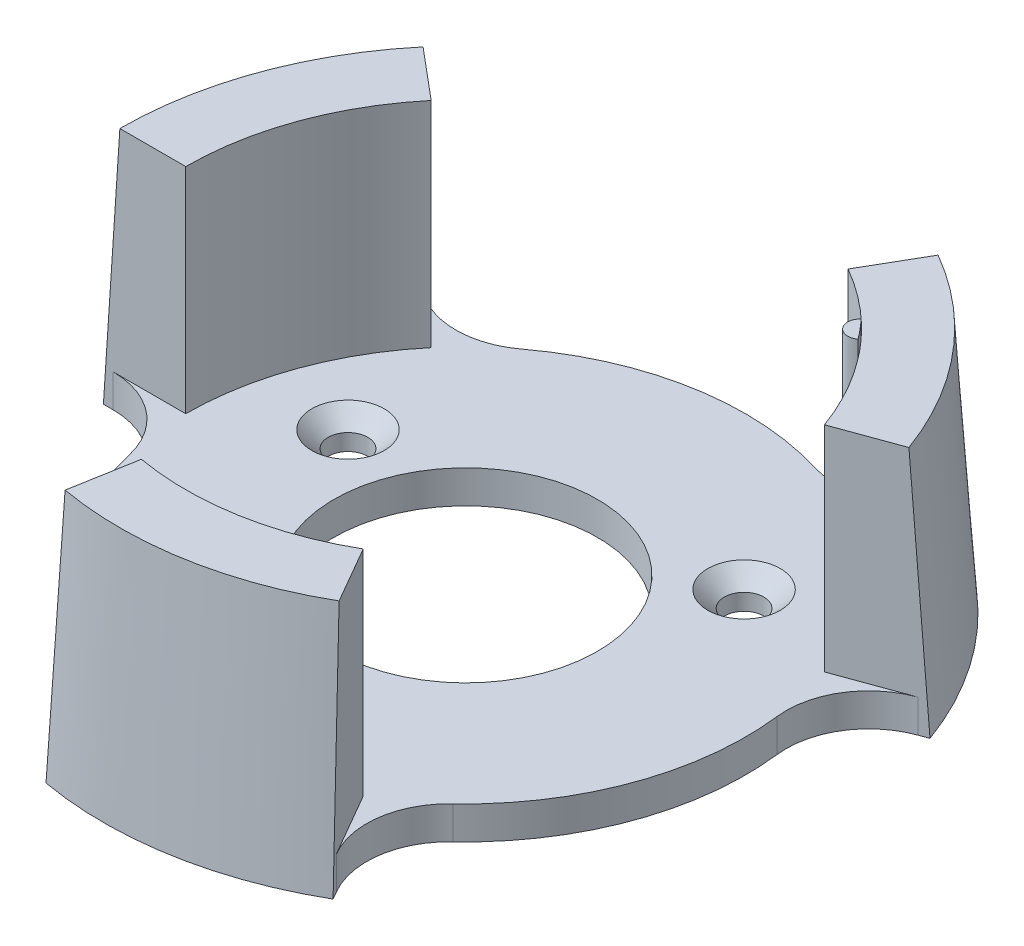
from build123d import *

# Parameters (mm, degrees)
SKETCH1_R                                    = 17
SKETCH1_R_2                                  = 8
BOSS_EXTRUDE4_DEPTH                          = 2
REVOLVE2_ANGLE                               = 40
CIRPATTERN1_COUNT                            = 3
FILLET1_R                                    = 5
CSK_FOR_M2_COUNTERSUNK_FLAT_HEAD_SCR_2_COUNT = 2
CSK_FOR_M2_COUNTERSUNK_FLAT_HEAD_SCR_2_PITCH = 20.784609691
CSK_FOR_M2_COUNTERSUNK_FLAT_HEAD_SCR_3_COUNT = 2
CSK_FOR_M2_COUNTERSUNK_FLAT_HEAD_SCR_3_PITCH = 20.747553677
BOSS_EXTRUDE6_DEPTH                          = 14


with BuildPart() as part:
    # Sketch1 → Boss-Extrude4 (new body)
    with BuildSketch(Plane(origin=(0, 0, 0), x_dir=(1, 0, 0), z_dir=(0, 1, 0))):
        with Locations(Location((0, 0, 0), (0, 0, 270))):
            Circle(SKETCH1_R)
        with Locations(Location((0, 0, 0), (0, 0, 270))):
            Circle(SKETCH1_R_2, mode=Mode.SUBTRACT)
    extrude(amount=BOSS_EXTRUDE4_DEPTH)

    # Sketch5 → Revolve2 (revolve)
    with BuildSketch(Plane.XY):
        Polygon((-17, 0), (-22, 0), (-21, 15), (-17, 15), align=None)
    revolve2 = revolve(axis=Axis((0, 9.813682869, 0), (0, -1, 0)), revolution_arc=REVOLVE2_ANGLE)

    # CirPattern1: Revolve2 ×3 about axis
    cirpattern1_axis = Axis((0, 0, 0), (0, 1, 0))
    for i in range(1, CIRPATTERN1_COUNT):
        add(revolve2.rotate(cirpattern1_axis, i * 360 / CIRPATTERN1_COUNT))

    # Fillet1
    fillet1_edges = [part.edges().sort_by_distance(p)[0] for p in [
        (-13.022755533, 1, -10.927389365),
        (-17, 1, 0),
        (-2.95201902, 1, 16.741731801),
        (8.5, 1, 14.722431864),
        (15.974774553, 1, -5.814342437),
        (8.5, 1, -14.722431864),
    ]]
    fillet(fillet1_edges, radius=FILLET1_R)

    # Sketch13 → CSK for M2 Countersunk Flat Head Screw1 (revolve, cut)
    with BuildSketch(Plane(origin=(2.083778132, 2, 11.817693036), x_dir=(0, 0, 1), z_dir=(1, 0, 0))):
        Polygon((0, 0), (0, 2), (1.2, 2), (1.2, 1), (2.2, 0), align=None)
    csk_for_m2_countersunk_flat_head_screw1 = revolve(axis=Axis((2.083778132, 8.35, 11.817693036), (0, -1, 0)), mode=Mode.SUBTRACT)

    # CSK for M2 Countersunk Flat Head Scr 2: CSK for M2 Countersunk Flat Head Screw1 ×2
    with Locations(*[Vector(0.3420201433256633, 0, -0.9396926207859104) * (i * CSK_FOR_M2_COUNTERSUNK_FLAT_HEAD_SCR_2_PITCH) for i in range(1, CSK_FOR_M2_COUNTERSUNK_FLAT_HEAD_SCR_2_COUNT)]):
        add(csk_for_m2_countersunk_flat_head_screw1, mode=Mode.SUBTRACT)

    # CSK for M2 Countersunk Flat Head Scr 3: CSK for M2 Countersunk Flat Head Screw1 ×2
    with Locations(*[Vector(-0.6419971087705412, 0, -0.7667070577021357) * (i * CSK_FOR_M2_COUNTERSUNK_FLAT_HEAD_SCR_3_PITCH) for i in range(1, CSK_FOR_M2_COUNTERSUNK_FLAT_HEAD_SCR_3_COUNT)]):
        add(csk_for_m2_countersunk_flat_head_screw1, mode=Mode.SUBTRACT)

    # Sketch24 → Boss-Extrude6 (add)
    with BuildSketch(Plane(origin=(0, 2, 0), x_dir=(1, 0, 0), z_dir=(0, 1, 0))):
        with BuildLine():
            ThreePointArc((12.528097784, 11.491160338), (12.448209945, 10.445288373), (13.492065142, 10.342348776))
            ThreePointArc((13.492065142, 10.342348776), (13.022755533, 10.927389365), (12.528097784, 11.491160338))
        make_face()
    extrude(amount=BOSS_EXTRUDE6_DEPTH)


solid = part.part
